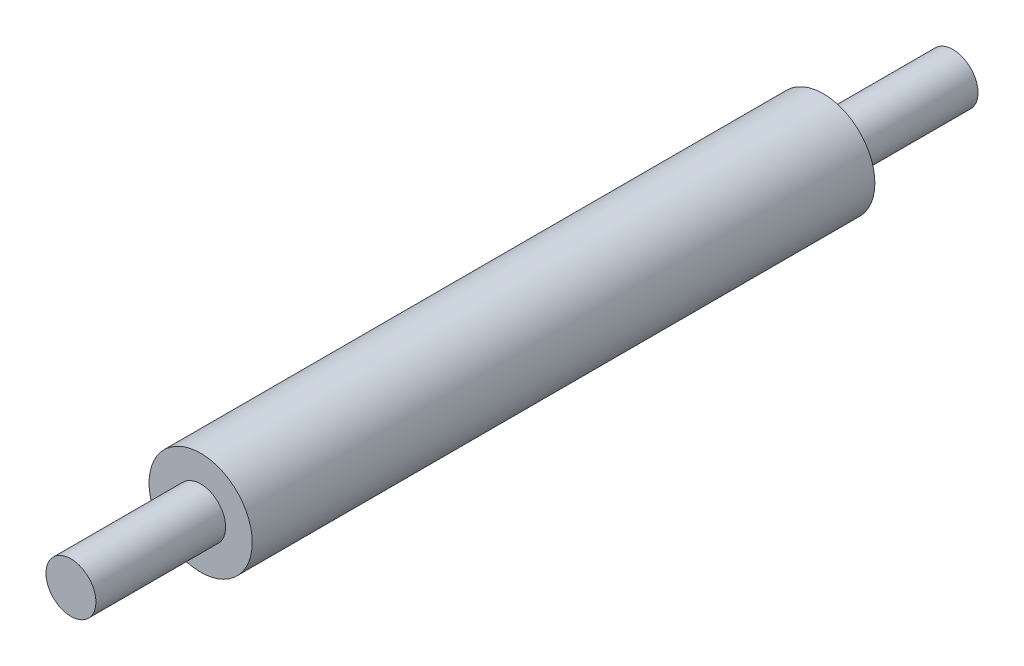
from build123d import *

# Parameters (mm, degrees)
SKETCH1_R           = 7.95
BOSS_EXTRUDE1_DEPTH = 48
SKETCH3_R           = 3.85
BOSS_EXTRUDE2_DEPTH = 20


with BuildPart() as part:
    # Sketch1 → Boss-Extrude1 (new, symmetric)
    with BuildSketch(Plane.XY):
        Circle(SKETCH1_R)
    extrude(amount=BOSS_EXTRUDE1_DEPTH, both=True)

    # Sketch3 → Boss-Extrude2 (add)
    with BuildSketch(Plane.XY.offset(48)):
        Circle(SKETCH3_R)
    boss_extrude2 = extrude(amount=BOSS_EXTRUDE2_DEPTH)

    # Mirror1: Boss-Extrude2 across plane
    add(boss_extrude2.mirror(Plane.XY))


solid = part.part
